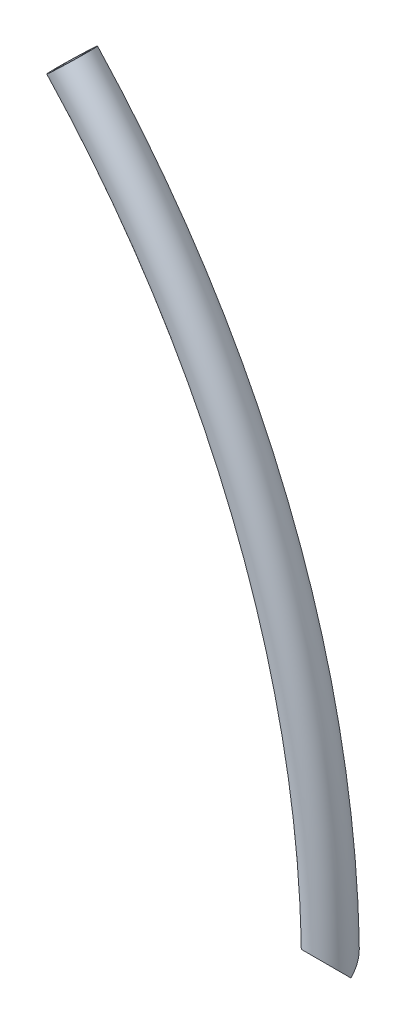
from build123d import *

# Parameters (mm, degrees)
SKETCH2_R          = 10.668
SKETCH2_R_2        = 7.8994
CUT_EXTRUDE2_DEPTH = 723.272399361
CUT_EXTRUDE4_START = 489.220558
CUT_EXTRUDE4_DEPTH = 21.447442


with BuildPart() as part:
    # Sweep1: sweep along a path in Sketch1
    with BuildLine(Plane.XY) as sweep1_path:
        ThreePointArc((0, 500), (353.553390593, 353.553390593), (500, 0))
    # Sketch2 → Sweep1 (sweep)
    with BuildSketch(Plane(origin=(0, 0, 0), x_dir=(1, 0, 0), z_dir=(0, 1, 0))):
        with Locations((500, 0)):
            Circle(SKETCH2_R)
        with Locations((500, 0)):
            Circle(SKETCH2_R_2, mode=Mode.SUBTRACT)
    sweep(path=sweep1_path.line)

    # Sketch4 → Cut-Extrude2 (cut, through all)
    with BuildSketch(Plane(origin=(0, 0, 0), x_dir=(0, 0, -1), z_dir=(1, 0, 0))):
        Polygon((0, 0), (-10.668, 10.668), (-10.668, -2.04612568), (10.668, -2.04612568), (10.668, 10.668), align=None)
    extrude(amount=CUT_EXTRUDE2_DEPTH, mode=Mode.SUBTRACT)

    # Sketch3 → Cut-Extrude4 (cut)
    with BuildSketch(Plane(origin=(0, 0, 0), x_dir=(1, 0, 0), z_dir=(0, 1, 0)).offset(CUT_EXTRUDE4_START)):
        Polygon((0, 0), (10.668, 10.668), (-11.575334071, 10.668), (-11.575334071, -10.668), (10.668, -10.668), align=None)
    extrude(amount=CUT_EXTRUDE4_DEPTH, mode=Mode.SUBTRACT)


with BuildPart() as body_2:
    # Split1: the piece on the far side of the plane
    add(part.part)
    split(bisect_by=Plane(origin=(-97.926528316, -91.317964988, -292.891733477), x_dir=(-0.7313537016191695, -0.6819983600624997, 0), z_dir=(0.6819983600624997, -0.7313537016191695, 1.2184435043554652e-15)), keep=Keep.BOTTOM)


with BuildPart() as part_1:
    add(part.part)

    # Split1
    split(bisect_by=Plane(origin=(-97.926528316, -91.317964988, -292.891733477), x_dir=(-0.7313537016191695, -0.6819983600624997, 0), z_dir=(0.6819983600624997, -0.7313537016191695, 1.2184435043554652e-15)), keep=Keep.TOP)


solid = part_1.part
